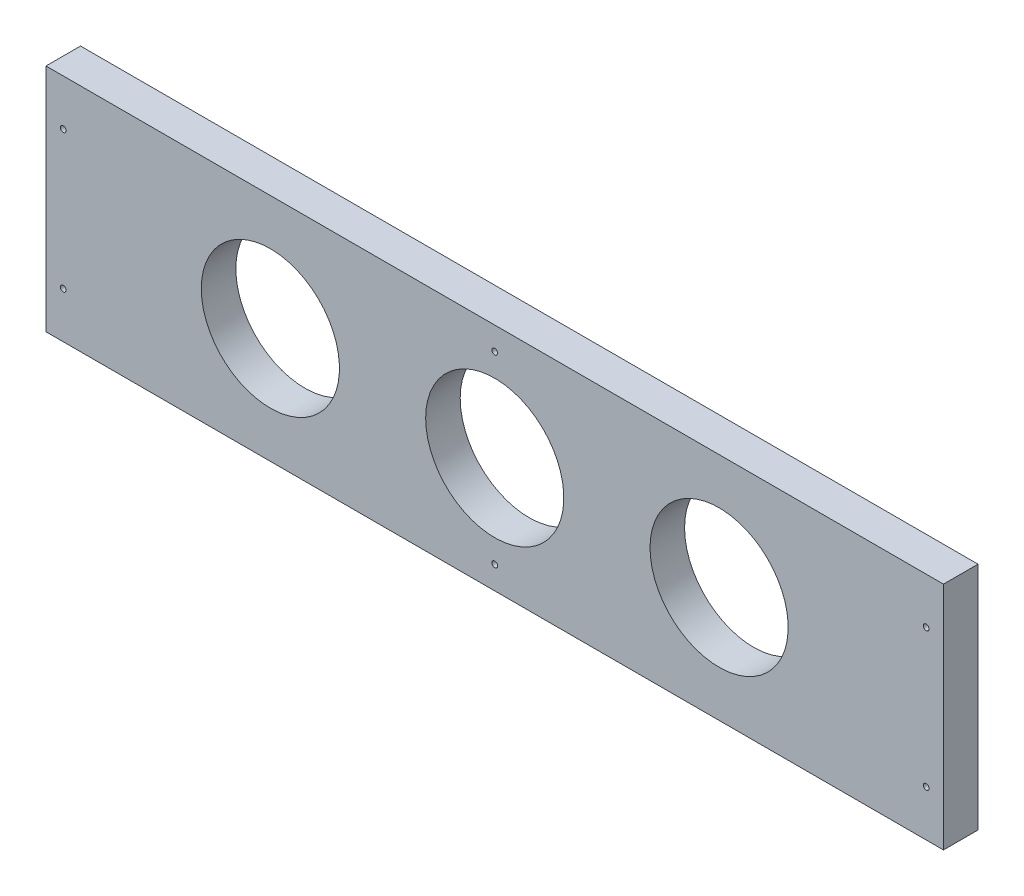
from build123d import *

# Parameters (mm, degrees)
SKETCH1_W           = 495.046
SKETCH1_H           = 127
BOSS_EXTRUDE1_DEPTH = 19.05
SKETCH2_R           = 38.1
CUT_EXTRUDE1_DEPTH  = 5423.392257673
HOLE1_D             = 3.175
HOLE1_DEPTH         = 50.8
HOLE1_CSINK_D       = 10.16
HOLE1_CSINK_ANGLE   = 82
HOLE1_TIP           = 0.953866233


with BuildPart() as part:
    # Sketch1 → Boss-Extrude1 (new body)
    with BuildSketch(Plane.XY):
        with Locations((90.196398512, 5348.331529292)):
            Rectangle(SKETCH1_W, SKETCH1_H)
    extrude(amount=BOSS_EXTRUDE1_DEPTH)

    # Sketch2 → Cut-Extrude1 (cut, through all)
    with BuildSketch(Plane(origin=(0, 0, 0), x_dir=(-1, 0, 0), z_dir=(0, 0, -1))):
        with Locations((-213.957898512, 5348.331529292)):
            Circle(SKETCH2_R)
        with Locations((-90.196398512, 5348.331529292)):
            Circle(SKETCH2_R)
        with Locations((33.565101488, 5348.331529292)):
            Circle(SKETCH2_R)
    extrude(amount=-CUT_EXTRUDE1_DEPTH, mode=Mode.SUBTRACT)

    # Hole1
    with Locations(Plane(origin=(90.196398512, 2347.321529292, 38.1), x_dir=(1, 0, 0), z_dir=(0, 0, 1))):
        with Locations((0, 2696.21), (-237.998, 3089.91), (-237.998, 3039.11), (-237.998, 2962.91), (-237.998, 2912.11), (-237.998, 2835.91), (-237.998, 2785.11), (-237.998, 2708.91), (237.998, 2708.91), (237.998, 2785.11), (237.998, 2835.91), (237.998, 2912.11), (237.998, 2962.91), (237.998, 3039.11), (237.998, 3089.91), (0, 3051.81), (0, 2950.21), (0, 2797.81)):
            CounterSinkHole(HOLE1_D / 2, HOLE1_CSINK_D / 2, depth=HOLE1_DEPTH, counter_sink_angle=HOLE1_CSINK_ANGLE)
            with Locations((0, 0, -(HOLE1_DEPTH + HOLE1_TIP / 2))):  # 118° drill point
                Cone(0, HOLE1_D / 2, HOLE1_TIP, mode=Mode.SUBTRACT)


solid = part.part
